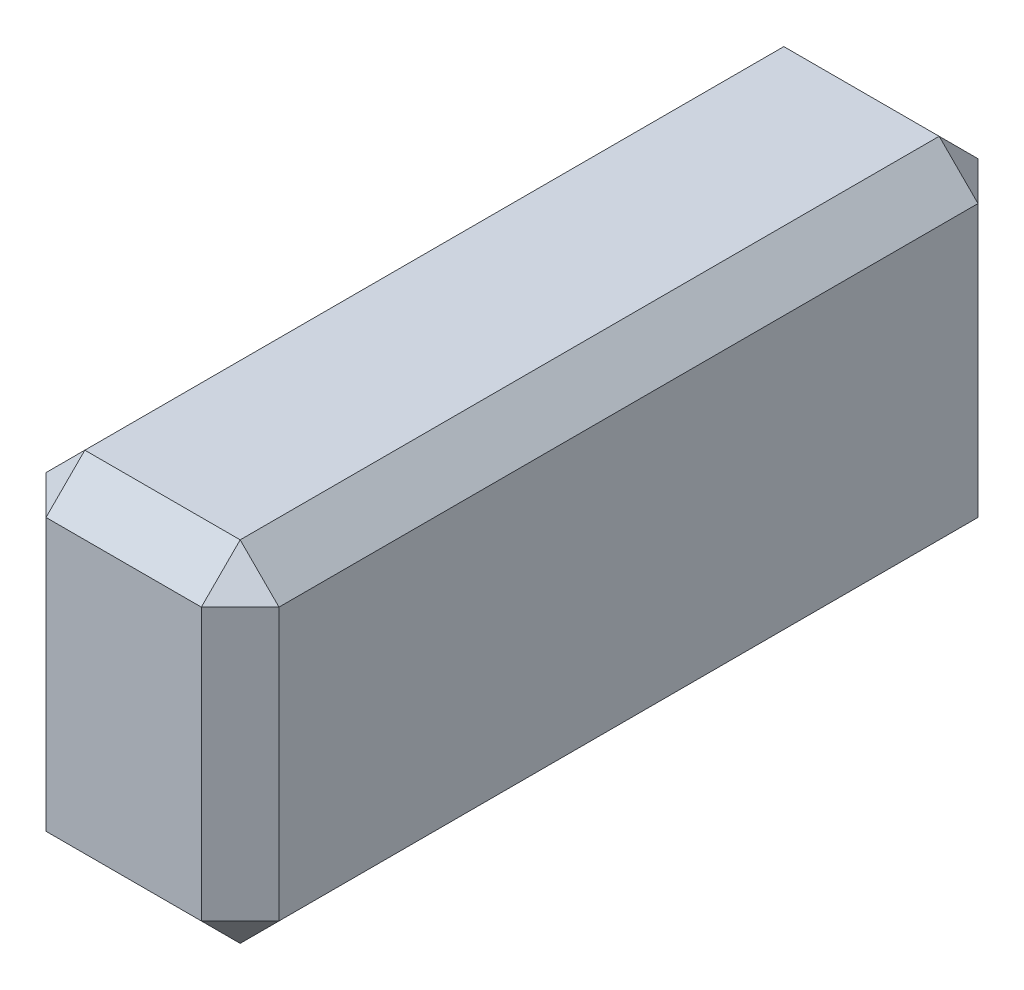
from build123d import *

# Parameters (mm, degrees)
SKETCH1_W           = 3
SKETCH1_H           = 4.5
BOSS_EXTRUDE1_DEPTH = 10
CHAMFER1_SIZE       = 0.5


with BuildPart() as part:
    # Sketch1 → Boss-Extrude1 (new body)
    with BuildSketch(Plane.XY):
        Rectangle(SKETCH1_W, SKETCH1_H)
    extrude(amount=BOSS_EXTRUDE1_DEPTH)

    # Chamfer1
    chamfer1_edges = [part.edges().sort_by_distance(p)[0] for p in [
        (-1.5, 0, 10),
        (0, -2.25, 10),
        (1.5, 0, 10),
        (0, -2.25, 0),
        (-1.5, 0, 0),
        (0, 2.25, 0),
        (1.5, 0, 0),
        (1.5, -2.25, 5),
        (-1.5, -2.25, 5),
        (-1.5, 2.25, 5),
        (1.5, 2.25, 5),
        (0, 2.25, 10),
    ]]
    chamfer(chamfer1_edges, length=CHAMFER1_SIZE)


solid = part.part
